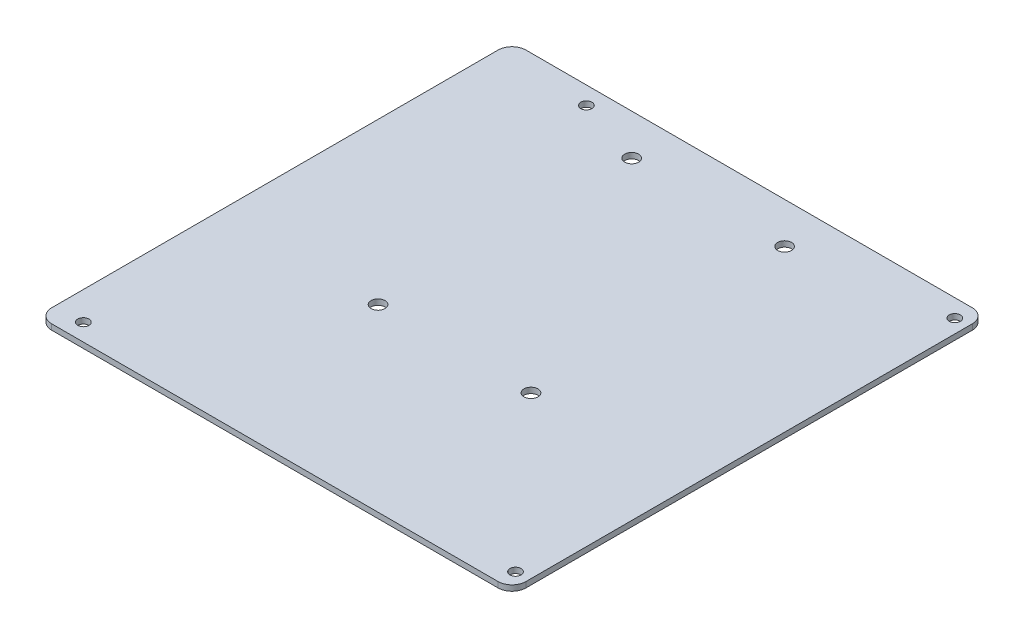
from build123d import *

# Parameters (mm, degrees)
SKETCH_1_R          = 2
EXTRUDE_1_DEPTH     = 2
SKETCH_3_R          = 2.5
CUT_EXTRUDE_1_DEPTH = 10


with BuildPart() as part:
    # Эскиз1 → Бобышка-Вытянуть1 (new body)
    with BuildSketch(Plane.XZ):
        with BuildLine():
            Line((80, 85), (-80, 85))
            ThreePointArc((-80, 85), (-83.535533906, 83.535533906), (-85, 80))
            Line((-85, 80), (-85, -80))
            ThreePointArc((-85, -80), (-83.535533906, -83.535533906), (-80, -85))
            Line((-80, -85), (80, -85))
            ThreePointArc((80, -85), (83.535533906, -83.535533906), (85, -80))
            Line((85, -80), (85, 80))
            ThreePointArc((85, 80), (83.535533906, 83.535533906), (80, 85))
        make_face()
        with Locations(Location((-74.84, 78.83, 0), (0, 0, 90))):
            Circle(SKETCH_1_R, mode=Mode.SUBTRACT)
        with Locations(Location((80.1, 78.83, 0), (0, 0, 90))):
            Circle(SKETCH_1_R, mode=Mode.SUBTRACT)
        with Locations(Location((80.1, -78.65, 0), (0, 0, 90))):
            Circle(SKETCH_1_R, mode=Mode.SUBTRACT)
        with Locations(Location((-51.98, -78.65, 0), (0, 0, 90))):
            Circle(SKETCH_1_R, mode=Mode.SUBTRACT)
    extrude(amount=-EXTRUDE_1_DEPTH)

    # Эскиз3 → Вырез-Вытянуть1 (cut)
    with BuildSketch(Plane(origin=(0, 2, 0), x_dir=(1, 0, 0), z_dir=(0, 1, 0))):
        with Locations(Location((-27.489542331, -20.533937546, 0), (0, 0, 270))):
            Circle(SKETCH_3_R)
        with Locations(Location((-27.489542331, 70.393970701, 0), (0, 0, 270))):
            Circle(SKETCH_3_R)
        with Locations(Location((27.334465925, -20.533937546, 0), (0, 0, 270))):
            Circle(SKETCH_3_R)
        with Locations(Location((27.334465925, 70.393970701, 0), (0, 0, 270))):
            Circle(SKETCH_3_R)
    extrude(amount=-CUT_EXTRUDE_1_DEPTH, mode=Mode.SUBTRACT)


solid = part.part
